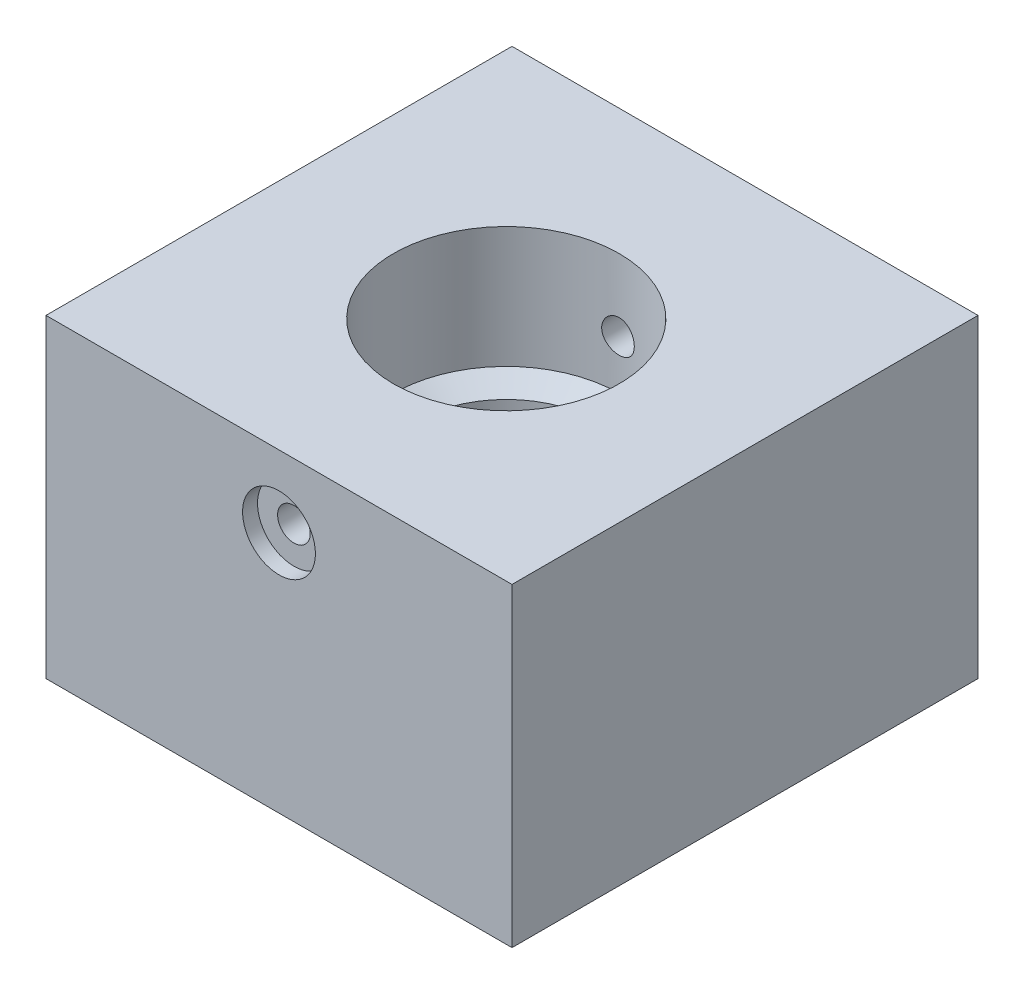
from build123d import *

# Parameters (mm, degrees)
SKETCH2_W                                           = 25.4
SKETCH2_H                                           = 17.146948585
BOSS_EXTRUDE1_DEPTH                                 = 12.7
F_7_16_20_TAPPED_HOLE1_D                            = 9.92124
F_7_16_20_TAPPED_HOLE1_DEPTH                        = 12.235907381
F_7_16_20_TAPPED_HOLE1_TIP                          = 2.980641204
F_7_16_CLEARANCE_HOLE3_D                            = 12.30376
F_7_16_CLEARANCE_HOLE3_DEPTH                        = 6.604
F_7_16_CLEARANCE_HOLE3_TIP                          = 3.696422425
CBORE_FOR_0_BINDING_HEAD_MACHINE_SCREW1_D           = 1.778
CBORE_FOR_0_BINDING_HEAD_MACHINE_SCREW1_CBORE_D     = 3.97002
CBORE_FOR_0_BINDING_HEAD_MACHINE_SCREW1_CBORE_DEPTH = 0.8128


with BuildPart() as part:
    # Sketch2 → Boss-Extrude1 (new, symmetric)
    with BuildSketch(Plane(origin=(0, 0, 0), x_dir=(0, 0, -1), z_dir=(1, 0, 0))):
        with Locations((0.311038218, -8.573474293)):
            Rectangle(SKETCH2_W, SKETCH2_H)
    extrude(amount=BOSS_EXTRUDE1_DEPTH, both=True)

    # 7/16-20 Tapped Hole1
    with Locations(Plane(origin=(0, 0, 0), x_dir=(1, 0, 0), z_dir=(0, 1, 0))):
        with Locations((0, 0)):
            Hole(F_7_16_20_TAPPED_HOLE1_D / 2, depth=F_7_16_20_TAPPED_HOLE1_DEPTH)
            with Locations((0, 0, -(F_7_16_20_TAPPED_HOLE1_DEPTH + F_7_16_20_TAPPED_HOLE1_TIP / 2))):  # 118° drill point
                Cone(0, F_7_16_20_TAPPED_HOLE1_D / 2, F_7_16_20_TAPPED_HOLE1_TIP, mode=Mode.SUBTRACT)

    # 7/16 Clearance Hole3
    with Locations(Plane(origin=(0, 0, 0), x_dir=(1, 0, 0), z_dir=(0, 1, 0))):
        with Locations((0, 0)):
            Hole(F_7_16_CLEARANCE_HOLE3_D / 2, depth=F_7_16_CLEARANCE_HOLE3_DEPTH)
            with Locations((0, 0, -(F_7_16_CLEARANCE_HOLE3_DEPTH + F_7_16_CLEARANCE_HOLE3_TIP / 2))):  # 118° drill point
                Cone(0, F_7_16_CLEARANCE_HOLE3_D / 2, F_7_16_CLEARANCE_HOLE3_TIP, mode=Mode.SUBTRACT)

    # CBORE for #0 Binding Head Machine Screw1 (through all)
    with Locations(Plane(origin=(0, -3.914304801, 12.388961782), x_dir=(1, 0, 0), z_dir=(0, 0, 1))):
        with Locations((0, 0)):
            CounterBoreHole(CBORE_FOR_0_BINDING_HEAD_MACHINE_SCREW1_D / 2, CBORE_FOR_0_BINDING_HEAD_MACHINE_SCREW1_CBORE_D / 2, CBORE_FOR_0_BINDING_HEAD_MACHINE_SCREW1_CBORE_DEPTH)


solid = part.part
